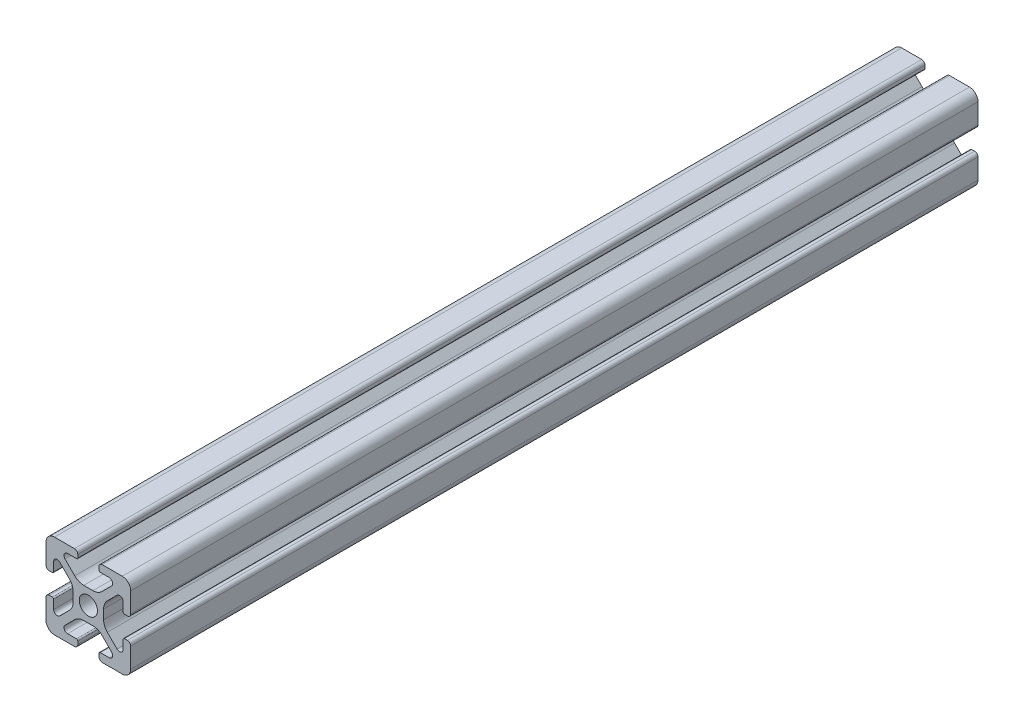
from build123d import *

# Parameters (mm, degrees)
BOSS_EXTRUDE1_DEPTH      = 100
BOSS_EXTRUDE1_DEPTH_BACK = 100
SKETCH3_R                = 2.15


with BuildPart() as part:
    # Sketch3 → Boss-Extrude1 (new, two sides: drawn at the far end of the back side and taken through both)
    with BuildSketch(Plane.XY.offset(-BOSS_EXTRUDE1_DEPTH_BACK)):
        with BuildLine():
            Line((3.2874, 10), (8, 10))
            ThreePointArc((8, 10), (9.414213562, 9.414213562), (10, 8))
            Line((10, 8), (10, 3.2874))
            ThreePointArc((10, 3.2874), (9.76937588, 2.73062412), (9.2126, 2.5))
            Line((9.2126, 2.5), (8.5048, 2.5))
            ThreePointArc((8.5048, 2.5), (8.289273853, 2.589273853), (8.2, 2.8048))
            Line((8.2, 2.8048), (8.2, 4.9118))
            ThreePointArc((8.2, 4.9118), (7.682565253, 5.686195824), (6.769103096, 5.504496904))
            Line((6.769103096, 5.504496904), (4.478679656, 3.214073464))
            ThreePointArc((4.478679656, 3.214073464), (3.828361402, 2.240803418), (3.6, 1.092753121))
            Line((3.6, 1.092753121), (3.6, -1.092753121))
            ThreePointArc((3.6, -1.092753121), (3.828361402, -2.240803418), (4.478679656, -3.214073464))
            Line((4.478679656, -3.214073464), (6.769103096, -5.504496904))
            ThreePointArc((6.769103096, -5.504496904), (7.682565253, -5.686195824), (8.2, -4.9118))
            Line((8.2, -4.9118), (8.2, -2.8048))
            ThreePointArc((8.2, -2.8048), (8.289273853, -2.589273853), (8.5048, -2.5))
            Line((8.5048, -2.5), (9.2126, -2.5))
            ThreePointArc((9.2126, -2.5), (9.76937588, -2.73062412), (10, -3.2874))
            Line((10, -3.2874), (10, -8))
            ThreePointArc((10, -8), (9.414213562, -9.414213562), (8, -10))
            Line((8, -10), (3.2874, -10))
            ThreePointArc((3.2874, -10), (2.73062412, -9.76937588), (2.5, -9.2126))
            Line((2.5, -9.2126), (2.5, -8.5048))
            ThreePointArc((2.5, -8.5048), (2.589273853, -8.289273853), (2.8048, -8.2))
            Line((2.8048, -8.2), (4.9118, -8.2))
            ThreePointArc((4.9118, -8.2), (5.686195824, -7.682565253), (5.504496904, -6.769103096))
            Line((5.504496904, -6.769103096), (3.214073464, -4.478679656))
            ThreePointArc((3.214073464, -4.478679656), (2.240803418, -3.828361402), (1.092753121, -3.6))
            Line((1.092753121, -3.6), (-1.092753121, -3.6))
            ThreePointArc((-1.092753121, -3.6), (-2.240803418, -3.828361402), (-3.214073464, -4.478679656))
            Line((-3.214073464, -4.478679656), (-5.504496904, -6.769103096))
            ThreePointArc((-5.504496904, -6.769103096), (-5.686195824, -7.682565253), (-4.9118, -8.2))
            Line((-4.9118, -8.2), (-2.8048, -8.2))
            ThreePointArc((-2.8048, -8.2), (-2.589273853, -8.289273853), (-2.5, -8.5048))
            Line((-2.5, -8.5048), (-2.5, -9.2126))
            ThreePointArc((-2.5, -9.2126), (-2.73062412, -9.76937588), (-3.2874, -10))
            Line((-3.2874, -10), (-8, -10))
            ThreePointArc((-8, -10), (-9.414213562, -9.414213562), (-10, -8))
            Line((-10, -8), (-10, -3.2874))
            ThreePointArc((-10, -3.2874), (-9.76937588, -2.73062412), (-9.2126, -2.5))
            Line((-9.2126, -2.5), (-8.5048, -2.5))
            ThreePointArc((-8.5048, -2.5), (-8.289273853, -2.589273853), (-8.2, -2.8048))
            Line((-8.2, -2.8048), (-8.2, -4.9118))
            ThreePointArc((-8.2, -4.9118), (-7.682565253, -5.686195824), (-6.769103096, -5.504496904))
            Line((-6.769103096, -5.504496904), (-4.478679656, -3.214073464))
            ThreePointArc((-4.478679656, -3.214073464), (-3.828361402, -2.240803418), (-3.6, -1.092753121))
            Line((-3.6, -1.092753121), (-3.6, 1.092753121))
            ThreePointArc((-3.6, 1.092753121), (-3.828361402, 2.240803418), (-4.478679656, 3.214073464))
            Line((-4.478679656, 3.214073464), (-6.769103096, 5.504496904))
            ThreePointArc((-6.769103096, 5.504496904), (-7.682565253, 5.686195824), (-8.2, 4.9118))
            Line((-8.2, 4.9118), (-8.2, 2.8048))
            ThreePointArc((-8.2, 2.8048), (-8.289273853, 2.589273853), (-8.5048, 2.5))
            Line((-8.5048, 2.5), (-9.2126, 2.5))
            ThreePointArc((-9.2126, 2.5), (-9.76937588, 2.73062412), (-10, 3.2874))
            Line((-10, 3.2874), (-10, 8))
            ThreePointArc((-10, 8), (-9.414213562, 9.414213562), (-8, 10))
            Line((-8, 10), (-3.2874, 10))
            ThreePointArc((-3.2874, 10), (-2.73062412, 9.76937588), (-2.5, 9.2126))
            Line((-2.5, 9.2126), (-2.5, 8.5048))
            ThreePointArc((-2.5, 8.5048), (-2.589273853, 8.289273853), (-2.8048, 8.2))
            Line((-2.8048, 8.2), (-4.9118, 8.2))
            ThreePointArc((-4.9118, 8.2), (-5.686195824, 7.682565253), (-5.504496904, 6.769103096))
            Line((-5.504496904, 6.769103096), (-3.214073464, 4.478679656))
            ThreePointArc((-3.214073464, 4.478679656), (-2.240803418, 3.828361402), (-1.092753121, 3.6))
            Line((-1.092753121, 3.6), (1.092753121, 3.6))
            ThreePointArc((1.092753121, 3.6), (2.240803418, 3.828361402), (3.214073464, 4.478679656))
            Line((3.214073464, 4.478679656), (5.504496904, 6.769103096))
            ThreePointArc((5.504496904, 6.769103096), (5.686195824, 7.682565253), (4.9118, 8.2))
            Line((4.9118, 8.2), (2.8048, 8.2))
            ThreePointArc((2.8048, 8.2), (2.589273853, 8.289273853), (2.5, 8.5048))
            Line((2.5, 8.5048), (2.5, 9.2126))
            ThreePointArc((2.5, 9.2126), (2.73062412, 9.76937588), (3.2874, 10))
        make_face()
        Circle(SKETCH3_R, mode=Mode.SUBTRACT)
    extrude(amount=BOSS_EXTRUDE1_DEPTH + BOSS_EXTRUDE1_DEPTH_BACK)


solid = part.part
